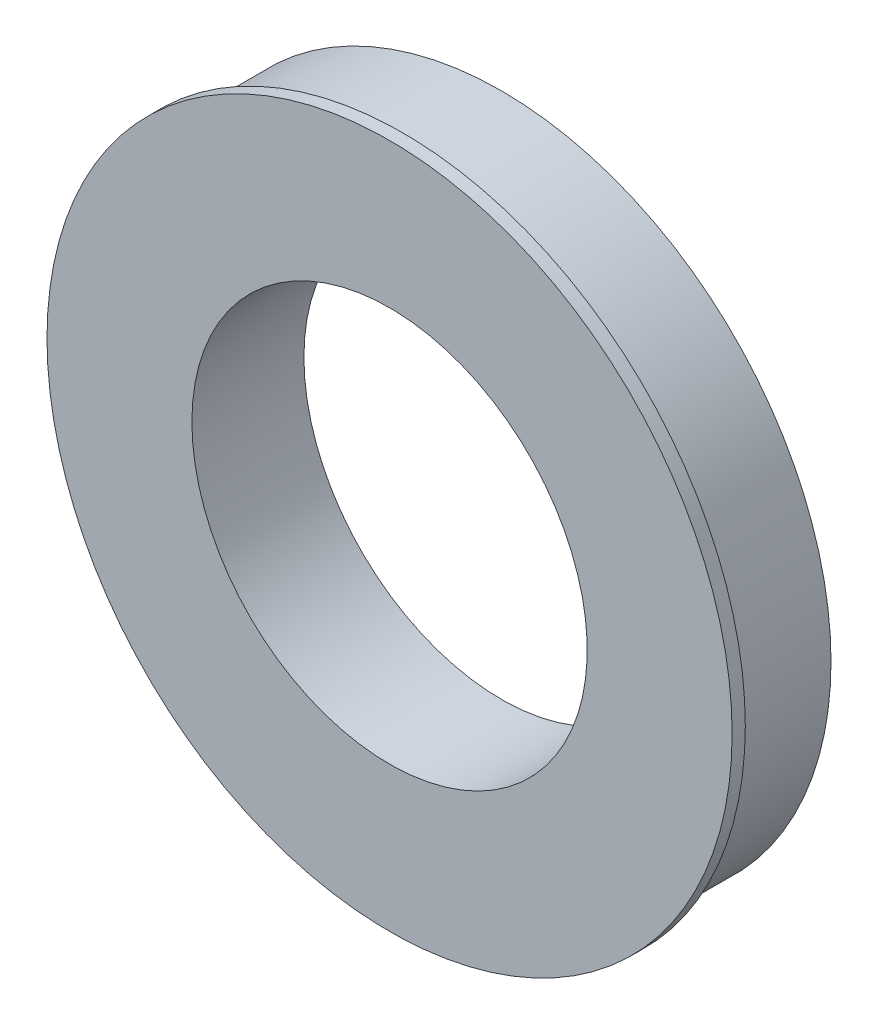
from build123d import *

# Parameters (mm, degrees)
SKETCH1_R           = 63.5
SKETCH1_R_2         = 38.1
BOSS_EXTRUDE1_DEPTH = 19.05
SKETCH2_R           = 66.03
SKETCH2_R_2         = 38.1
BOSS_EXTRUDE2_DEPTH = 2.54


with BuildPart() as part:
    # Sketch1 → Boss-Extrude1 (new body)
    with BuildSketch(Plane.XY):
        with Locations(Location((0, 0, 0), (0, 0, 180))):
            Circle(SKETCH1_R)
        with Locations(Location((0, 0, 0), (0, 0, 180))):
            Circle(SKETCH1_R_2, mode=Mode.SUBTRACT)
    extrude(amount=BOSS_EXTRUDE1_DEPTH)

    # Sketch2 → Boss-Extrude2 (add)
    with BuildSketch(Plane.XY.offset(19.05)):
        Circle(SKETCH2_R)
        with Locations(Location((0, 0, 0), (0, 0, 180))):
            Circle(SKETCH2_R_2, mode=Mode.SUBTRACT)
    extrude(amount=BOSS_EXTRUDE2_DEPTH)


solid = part.part
